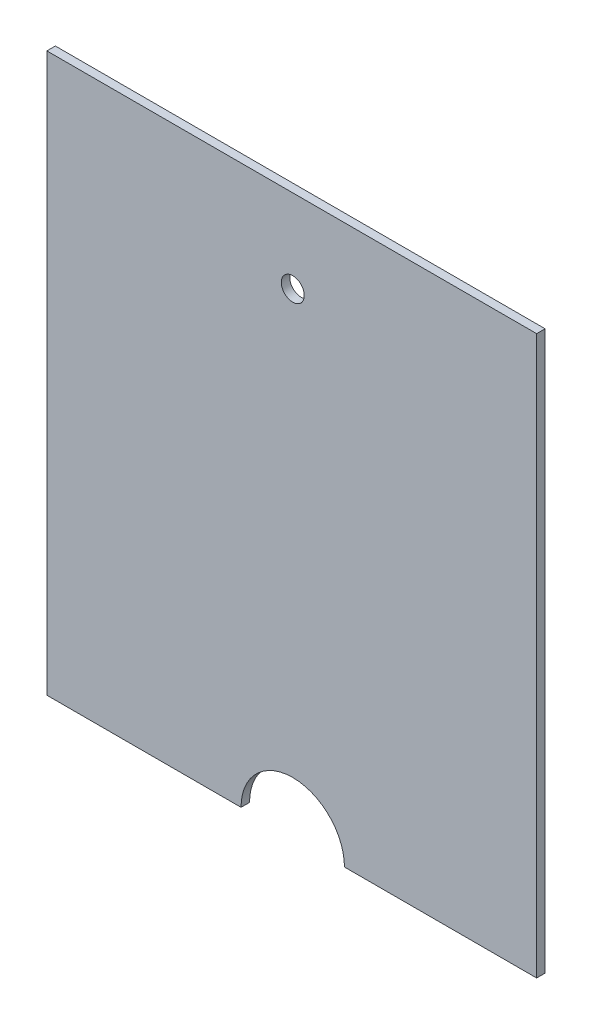
from build123d import *

# Parameters (mm, degrees)
SKETCH1_R           = 4
BOSS_EXTRUDE1_DEPTH = 2.95


with BuildPart() as part:
    # Sketch1 → Boss-Extrude1 (new body)
    with BuildSketch(Plane.XY):
        with BuildLine():
            Line((-135.14739229, 81.571587302), (-135.14739229, -112.698412698))
            Line((-135.14739229, -112.698412698), (-67.552558868, -112.698412698))
            ThreePointArc((-67.552558868, -112.698412698), (-49.552558868, -94.698412698), (-31.552558868, -112.698412698))
            Line((-31.552558868, -112.698412698), (35.35260771, -112.698412698))
            Line((35.35260771, -112.698412698), (35.35260771, 81.571587302))
            Line((35.35260771, 81.571587302), (-135.14739229, 81.571587302))
        make_face()
        with Locations((-49.552558868, 52.604329301)):
            Circle(SKETCH1_R, mode=Mode.SUBTRACT)
    extrude(amount=BOSS_EXTRUDE1_DEPTH)


solid = part.part
